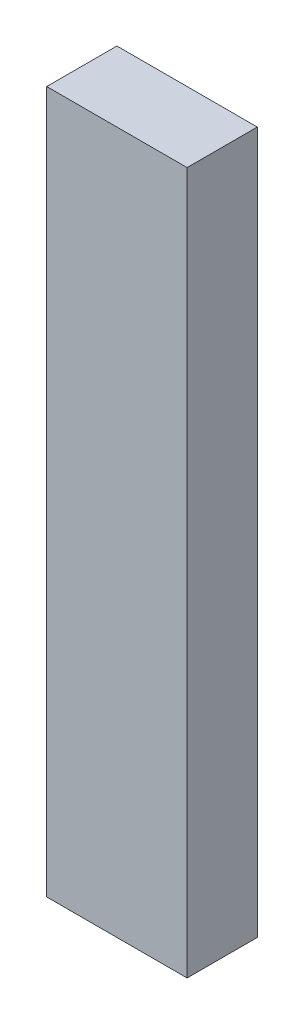
from build123d import *

# Parameters (mm, degrees)
SKETCH5_W           = 8
SKETCH5_H           = 4
BOSS_EXTRUDE4_DEPTH = 40


with BuildPart() as part:
    # Sketch5 → Boss-Extrude4 (new body)
    with BuildSketch(Plane(origin=(0, 1, 0), x_dir=(1, 0, 0), z_dir=(0, 1, 0))):
        Rectangle(SKETCH5_W, SKETCH5_H)
    extrude(amount=BOSS_EXTRUDE4_DEPTH)


solid = part.part
